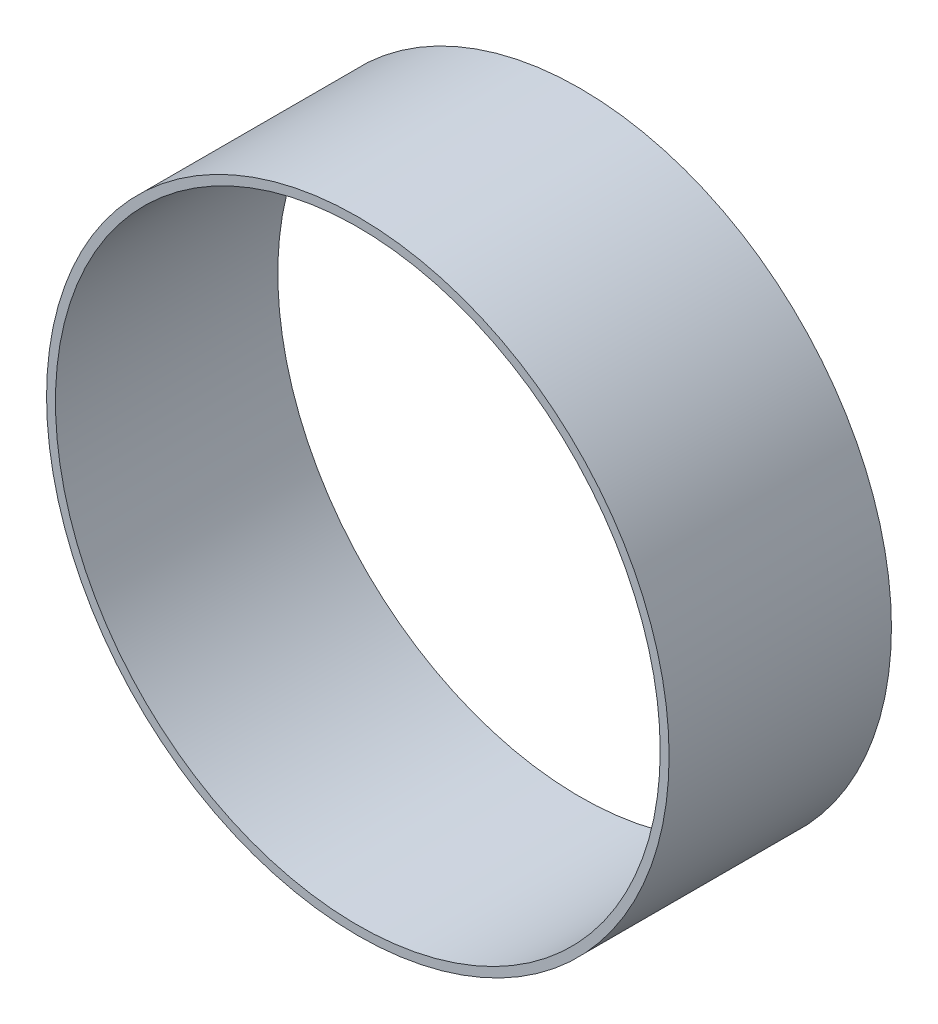
from build123d import *

# Parameters (mm, degrees)
SKETCH_1_W = 50
SKETCH_1_H = 2


with BuildPart() as part:
    # Эскиз1 → Повернуть1 (revolve)
    with BuildSketch(Plane(origin=(0, 0, 0), x_dir=(0, 0, -1), z_dir=(1, 0, 0)), mode=Mode.PRIVATE) as revolve_1_sk:
        with Locations((25, 69)):
            Rectangle(SKETCH_1_W, SKETCH_1_H)
    revolve(revolve_1_sk.sketch.rotate(Axis((0, 0, 0), (0, 0, -1)), 90), axis=Axis((0, 0, 0), (0, 0, -1)))


solid = part.part
